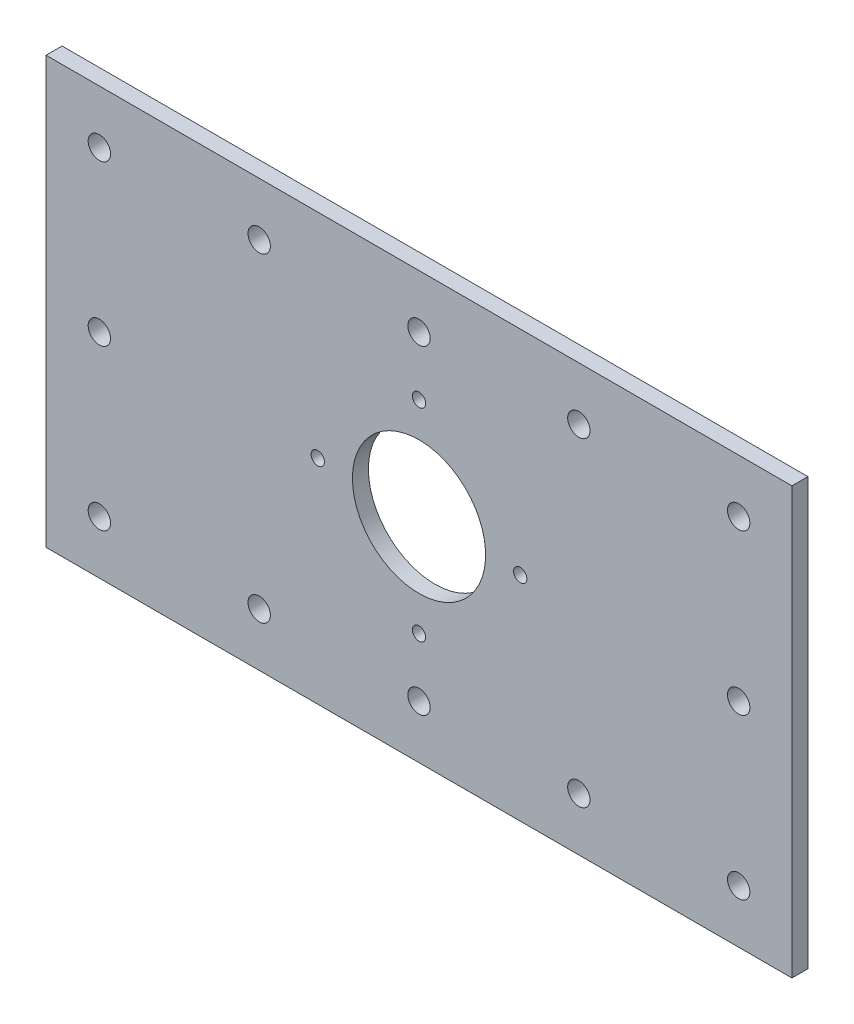
from build123d import *

# Parameters (mm, degrees)
SKETCH_1_W               = 140
SKETCH_1_H               = 80
EXTRUDE_1_DEPTH          = 3
SKETCH_2_R               = 2.1
CUT_EXTRUDE_1_DEPTH      = 81.678373806
CUT_EXTRUDE_2_DEPTH      = 81.678373806
CUT_EXTRUDE_2_DEPTH_BACK = 81.678373806
SKETCH_3_R               = 1.25
CUT_EXTRUDE_3_DEPTH      = 81.678373806
CUT_EXTRUDE_3_DEPTH_BACK = 81.678373806
SKETCH_4_R               = 12.5


with BuildPart() as part:
    # 草图1 → 凸台-拉伸1 (new body)
    with BuildSketch(Plane.XY):
        Rectangle(SKETCH_1_W, SKETCH_1_H)
    extrude(amount=EXTRUDE_1_DEPTH)

    # 草图2 → 切除-拉伸1 (cut, through all)
    with BuildSketch(Plane.XY.offset(3)):
        with Locations((-60, 30)):
            Circle(SKETCH_2_R)
        with Locations((-30, 30)):
            Circle(SKETCH_2_R)
        with Locations((0, 30)):
            Circle(SKETCH_2_R)
        with Locations((30, 30)):
            Circle(SKETCH_2_R)
        with Locations((60, 30)):
            Circle(SKETCH_2_R)
        with Locations((-60, 0)):
            Circle(SKETCH_2_R)
        with Locations((-60, -30)):
            Circle(SKETCH_2_R)
        with Locations((-60, -60)):
            Circle(SKETCH_2_R)
        with Locations((-60, -90)):
            Circle(SKETCH_2_R)
        with Locations((-60, -120)):
            Circle(SKETCH_2_R)
        with Locations((-60, -150)):
            Circle(SKETCH_2_R)
        with Locations((-60, -180)):
            Circle(SKETCH_2_R)
        with Locations((-60, -210)):
            Circle(SKETCH_2_R)
        with Locations((60, -210)):
            Circle(SKETCH_2_R)
        with Locations((60, -180)):
            Circle(SKETCH_2_R)
        with Locations((60, -150)):
            Circle(SKETCH_2_R)
        with Locations((60, -120)):
            Circle(SKETCH_2_R)
        with Locations((60, -90)):
            Circle(SKETCH_2_R)
        with Locations((60, -60)):
            Circle(SKETCH_2_R)
        with Locations(Location((60, -30, 0), (0, 0, 180))):
            Circle(SKETCH_2_R)
        with Locations(Location((60, 0, 0), (0, 0, 180))):
            Circle(SKETCH_2_R)
        with Locations(Location((30, -30, 0), (0, 0, 180))):
            Circle(SKETCH_2_R)
        with Locations(Location((0, -30, 0), (0, 0, 180))):
            Circle(SKETCH_2_R)
        with Locations(Location((-30, -30, 0), (0, 0, 180))):
            Circle(SKETCH_2_R)
    extrude(amount=-CUT_EXTRUDE_1_DEPTH, mode=Mode.SUBTRACT)

    # 草图3 → 切除-拉伸2 (cut, two sides: drawn at the far end of the back side and taken through both)
    with BuildSketch(Plane(origin=(0, 0, 0), x_dir=(-1, 0, 0), z_dir=(0, 0, -1)).offset(-CUT_EXTRUDE_2_DEPTH_BACK)):
        with Locations((19, 0)):
            Circle(SKETCH_3_R)
        with Locations((0, -19)):
            Circle(SKETCH_3_R)
        with Locations((-19, 0)):
            Circle(SKETCH_3_R)
        with Locations((0, 19)):
            Circle(SKETCH_3_R)
    extrude(amount=CUT_EXTRUDE_2_DEPTH + CUT_EXTRUDE_2_DEPTH_BACK, mode=Mode.SUBTRACT)

    # 草图4 → 切除-拉伸3 (cut, two sides: drawn at the far end of the back side and taken through both)
    with BuildSketch(Plane(origin=(0, 0, 0), x_dir=(-1, 0, 0), z_dir=(0, 0, -1)).offset(-CUT_EXTRUDE_3_DEPTH_BACK)):
        Circle(SKETCH_4_R)
    extrude(amount=CUT_EXTRUDE_3_DEPTH + CUT_EXTRUDE_3_DEPTH_BACK, mode=Mode.SUBTRACT)


solid = part.part
